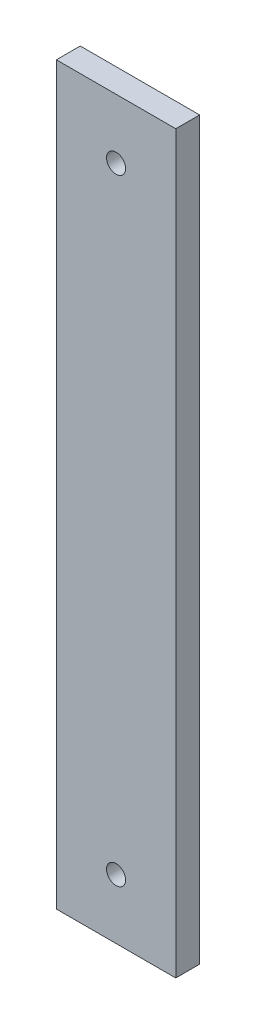
from build123d import *

# Parameters (mm, degrees)
SKETCH1_W           = 50
SKETCH1_H           = 10
BOSS_EXTRUDE1_DEPTH = 154
SKETCH2_R           = 4
CUT_EXTRUDE1_DEPTH  = 157.336176236


with BuildPart() as part:
    # Sketch1 → Boss-Extrude1 (new, symmetric)
    with BuildSketch(Plane(origin=(0, 0, 0), x_dir=(1, 0, 0), z_dir=(0, 1, 0))):
        Rectangle(SKETCH1_W, SKETCH1_H)
    extrude(amount=BOSS_EXTRUDE1_DEPTH, both=True)

    # Sketch2 → Cut-Extrude1 (cut, through all)
    with BuildSketch(Plane(origin=(0, 0, -5), x_dir=(-1, 0, 0), z_dir=(0, 0, -1))):
        with Locations((0, -129)):
            Circle(SKETCH2_R)
        with Locations(Location((0, 129, 0), (0, 0, 180))):
            Circle(SKETCH2_R)
    extrude(amount=-CUT_EXTRUDE1_DEPTH, mode=Mode.SUBTRACT)


solid = part.part
